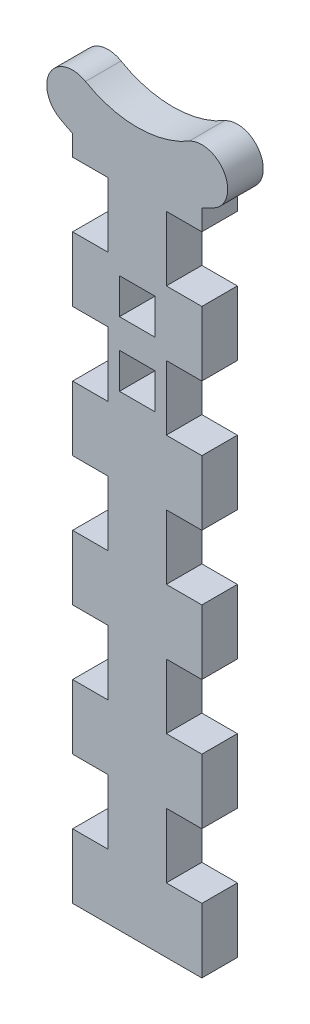
from build123d import *

# Parameters (mm, degrees)
EXTRUDE_1_DEPTH     = 5.5
SKETCH_2_W          = 5.5
SKETCH_2_H          = 10
CUT_EXTRUDE_1_DEPTH = 126.901747406
SKETCH_5_W          = 5.5
SKETCH_5_H          = 5.5
CUT_EXTRUDE_2_DEPTH = 126.901747406


with BuildPart() as part:
    # ｽｹｯﾁ1 → ﾎﾞｽ - 押し出し1 (new body)
    with BuildSketch(Plane.XY):
        with BuildLine():
            Line((-10, -21.817424229), (-10, -125))
            Line((-10, -125), (10, -125))
            Line((10, -125), (10, -21.817424229))
            ThreePointArc((10, -21.817424229), (11.012114986, -21.324477099), (12, -20.784609691))
            ThreePointArc((12, -20.784609691), (13.464101615, -15.320508076), (8, -13.856406461))
            ThreePointArc((8, -13.856406461), (0, -16), (-8, -13.856406461))
            ThreePointArc((-8, -13.856406461), (-13.464101615, -15.320508076), (-12, -20.784609691))
            ThreePointArc((-12, -20.784609691), (-11.012114986, -21.324477099), (-10, -21.817424229))
        make_face()
    extrude(amount=EXTRUDE_1_DEPTH)

    # ｽｹｯﾁ2 → ｶｯﾄ - 押し出し1 (cut, through all)
    with BuildSketch(Plane.XY.offset(5.5)):
        with Locations((-7.25, -90)):
            Rectangle(SKETCH_2_W, SKETCH_2_H)
        with Locations((-7.25, -110)):
            Rectangle(SKETCH_2_W, SKETCH_2_H)
        with Locations((-7.25, -70)):
            Rectangle(SKETCH_2_W, SKETCH_2_H)
        with Locations((-7.25, -50)):
            Rectangle(SKETCH_2_W, SKETCH_2_H)
        with Locations((-7.25, -30)):
            Rectangle(SKETCH_2_W, SKETCH_2_H)
        with Locations((7.25, -110)):
            Rectangle(SKETCH_2_W, SKETCH_2_H)
        with Locations((7.25, -90)):
            Rectangle(SKETCH_2_W, SKETCH_2_H)
        with Locations((7.25, -70)):
            Rectangle(SKETCH_2_W, SKETCH_2_H)
        with Locations((7.25, -50)):
            Rectangle(SKETCH_2_W, SKETCH_2_H)
        with Locations((7.25, -30)):
            Rectangle(SKETCH_2_W, SKETCH_2_H)
    extrude(amount=-CUT_EXTRUDE_1_DEPTH, mode=Mode.SUBTRACT)

    # ｽｹｯﾁ5 → ｶｯﾄ - 押し出し2 (cut, through all)
    with BuildSketch(Plane.XY.offset(5.5)):
        with Locations((0, -40)):
            Rectangle(SKETCH_5_W, SKETCH_5_H)
        with Locations((0, -50)):
            Rectangle(SKETCH_5_W, SKETCH_5_H)
    extrude(amount=-CUT_EXTRUDE_2_DEPTH, mode=Mode.SUBTRACT)


solid = part.part
